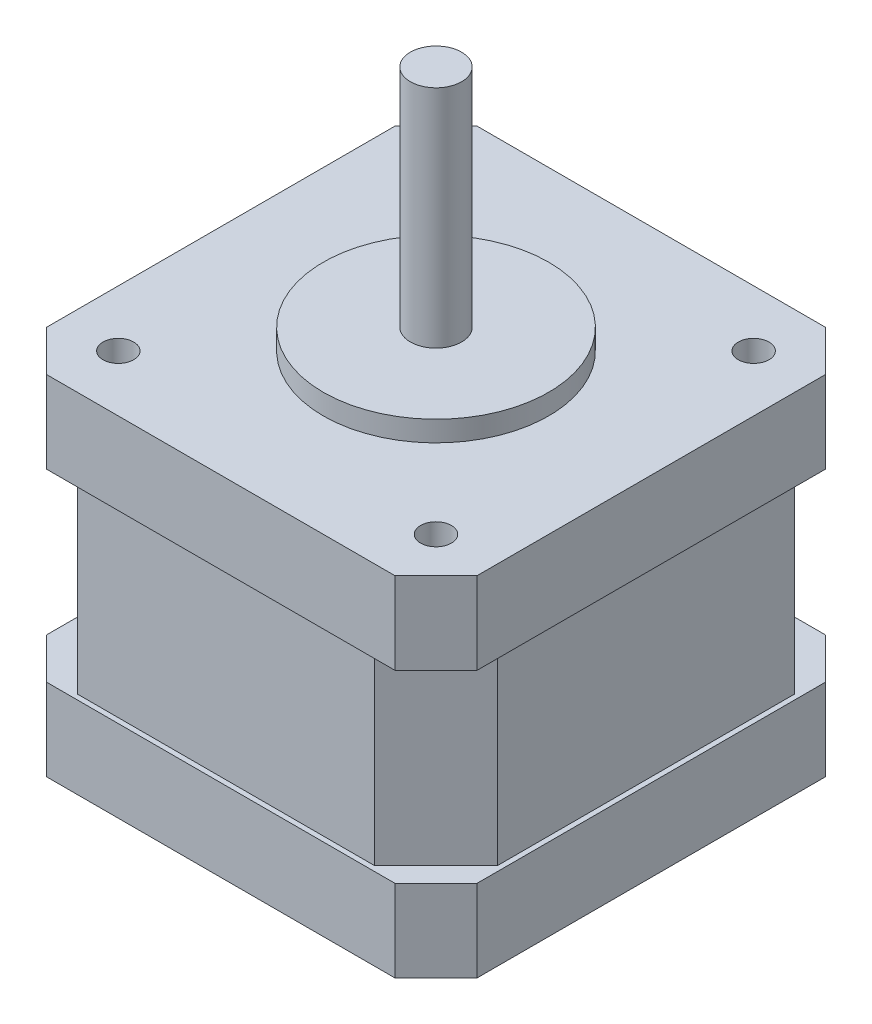
from build123d import *

# Parameters (mm, degrees)
SKETCH1_W           = 42
SKETCH1_H           = 42
BOSS_EXTRUDE1_DEPTH = 8
LPATTERN2_COUNT     = 2
LPATTERN2_PITCH     = 26
BOSS_EXTRUDE4_REACH = 41.472
SKETCH5_W           = 41
SKETCH5_H           = 41
CHAMFER2_SIZE       = 6
CHAMFER1_SIZE       = 4
SKETCH2_R           = 11
BOSS_EXTRUDE2_DEPTH = 2
SKETCH3_R           = 2.5
BOSS_EXTRUDE3_DEPTH = 22
SKETCH6_R           = 1.5
CUT_EXTRUDE1_DEPTH  = 7


with BuildPart() as part:
    # Sketch1 → Boss-Extrude1 (new body)
    with BuildSketch(Plane(origin=(0, 0, 0), x_dir=(1, 0, 0), z_dir=(0, 1, 0))):
        Rectangle(SKETCH1_W, SKETCH1_H)
    extrude(amount=BOSS_EXTRUDE1_DEPTH)


with BuildPart() as lpattern2_1:
    # LPattern2: pattern copy
    add(part.part.moved(Location(Vector(0, -1, 0) * (1 * LPATTERN2_PITCH))))

    # Sketch5 → Boss-Extrude4 (add, up to next)
    with BuildSketch(Plane.XZ, mode=Mode.PRIVATE) as boss_extrude4_sk1:
        Rectangle(SKETCH5_W, SKETCH5_H)
    boss_extrude4_tool1 = extrude(boss_extrude4_sk1.sketch, amount=BOSS_EXTRUDE4_REACH, mode=Mode.PRIVATE) - lpattern2_1.part

    add(part.part)  # Boss-Extrude4 merges part
    add(boss_extrude4_tool1.solids().sort_by_distance((0, 0, 0))[0])

    # Chamfer2
    chamfer2_edges = [lpattern2_1.edges().sort_by_distance(p)[0] for p in [
        (20.5, -9, 20.5),
        (-20.5, -9, 20.5),
        (-20.5, -9, -20.5),
        (20.5, -9, -20.5),
    ]]
    chamfer(chamfer2_edges, length=CHAMFER2_SIZE)

    # Chamfer1
    chamfer1_edges = [lpattern2_1.edges().sort_by_distance(p)[0] for p in [
        (-21, -22, -21),
        (-21, -22, 21),
        (21, -22, 21),
        (21, -22, -21),
        (-21, 4, -21),
        (21, 4, -21),
        (21, 4, 21),
        (-21, 4, 21),
    ]]
    chamfer(chamfer1_edges, length=CHAMFER1_SIZE)

    # Sketch2 → Boss-Extrude2 (add)
    with BuildSketch(Plane(origin=(0, 8, 0), x_dir=(1, 0, 0), z_dir=(0, 1, 0))):
        with Locations(Location((0, 0, 0), (0, 0, 270))):
            Circle(SKETCH2_R)
    extrude(amount=BOSS_EXTRUDE2_DEPTH)

    # Sketch3 → Boss-Extrude3 (add)
    with BuildSketch(Plane(origin=(0, 10, 0), x_dir=(1, 0, 0), z_dir=(0, 1, 0))):
        with Locations(Location((0, 0, 0), (0, 0, 270))):
            Circle(SKETCH3_R)
    extrude(amount=BOSS_EXTRUDE3_DEPTH)

    # Sketch6 → Cut-Extrude1 (cut)
    with BuildSketch(Plane(origin=(0, 8, 0), x_dir=(1, 0, 0), z_dir=(0, 1, 0))):
        with Locations(Location((-15.5, 15.5, 0), (0, 0, 270))):
            Circle(SKETCH6_R)
        with Locations(Location((15.5, 15.5, 0), (0, 0, 270))):
            Circle(SKETCH6_R)
        with Locations(Location((15.5, -15.5, 0), (0, 0, 270))):
            Circle(SKETCH6_R)
        with Locations(Location((-15.5, -15.5, 0), (0, 0, 270))):
            Circle(SKETCH6_R)
    extrude(amount=-CUT_EXTRUDE1_DEPTH, mode=Mode.SUBTRACT)


solid = lpattern2_1.part
